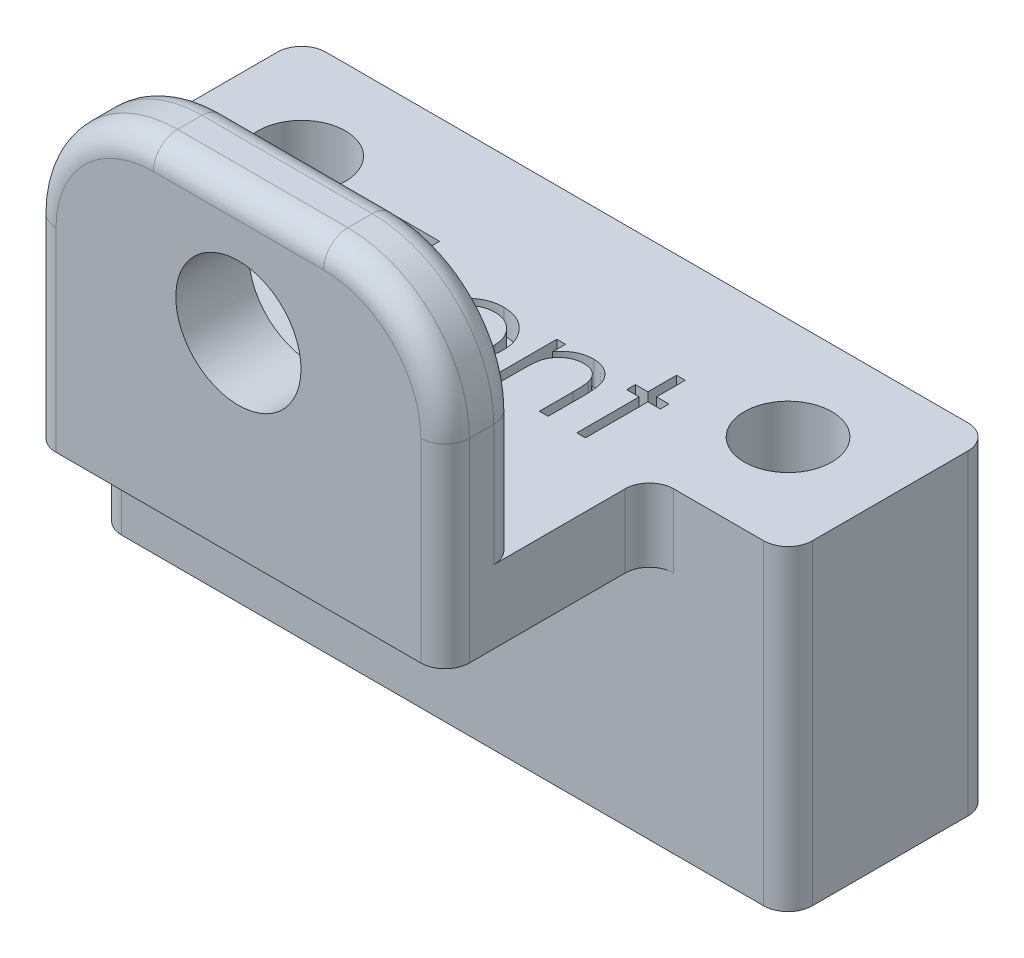
from build123d import *

# Parameters (mm, degrees)
SKETCH1_W                 = 8.4
SKETCH1_H                 = 3
BOSS_EXTRUDE1_DEPTH       = 17
SKETCH1_3_W               = 8.4
SKETCH1_3_H               = 3
BOSS_EXTRUDE3_DEPTH       = 5.7
BOSS_EXTRUDE4_START       = 17
SKETCH1_4_W               = 8.4
SKETCH1_4_H               = 3
BOSS_EXTRUDE4_DEPTH       = 5.7
F_5_0MM_DOWEL_HOLE1_D     = 5.15
F_5_0MM_DOWEL_HOLE1_DEPTH = 3
F_5_0MM_DOWEL_HOLE1_TIP   = 1.547216094
FILLET1_R                 = 5
M3_CLEARANCE_HOLE1_D      = 3.6
FILLET2_R                 = 1
BOSS_EXTRUDE5_START       = 10
SKETCH6_R                 = 1.8
BOSS_EXTRUDE5_DEPTH       = 10
CUT_EXTRUDE1_DEPTH        = 1


with BuildPart() as part:
    # Sketch1 → Boss-Extrude1 (new body)
    with BuildSketch(Plane(origin=(0, 0, 0), x_dir=(0, 0, -1), z_dir=(1, 0, 0))):
        Polygon((0, 13), (0, 0), (8.4, 0), (8.4, 3), (3, 3), (3, 13), align=None)
        with Locations((12.6, 1.5)):
            Rectangle(SKETCH1_W, SKETCH1_H)
    extrude(amount=BOSS_EXTRUDE1_DEPTH)

    # Sketch1<3> → Boss-Extrude3 (add)
    with BuildSketch(Plane(origin=(0, 0, 0), x_dir=(0, 0, -1), z_dir=(1, 0, 0))):
        with Locations((12.6, 1.5)):
            Rectangle(SKETCH1_3_W, SKETCH1_3_H)
    extrude(amount=-BOSS_EXTRUDE3_DEPTH)

    # Sketch1<4> → Boss-Extrude4 (add)
    with BuildSketch(Plane(origin=(0, 0, 0), x_dir=(0, 0, -1), z_dir=(1, 0, 0)).offset(BOSS_EXTRUDE4_START)):
        with Locations((12.6, 1.5)):
            Rectangle(SKETCH1_4_W, SKETCH1_4_H)
    extrude(amount=BOSS_EXTRUDE4_DEPTH)

    # Ø5.0mm Dowel Hole1
    with Locations(Plane.XY):
        with Locations((8.5, 8)):
            Hole(F_5_0MM_DOWEL_HOLE1_D / 2, depth=F_5_0MM_DOWEL_HOLE1_DEPTH)
            with Locations((0, 0, -(F_5_0MM_DOWEL_HOLE1_DEPTH + F_5_0MM_DOWEL_HOLE1_TIP / 2))):  # 118° drill point
                Cone(0, F_5_0MM_DOWEL_HOLE1_D / 2, F_5_0MM_DOWEL_HOLE1_TIP, mode=Mode.SUBTRACT)

    # Fillet1
    fillet1_edges = [part.edges().sort_by_distance(p)[0] for p in [
        (17, 13, -1.5),
        (0, 13, -1.5),
    ]]
    fillet(fillet1_edges, radius=FILLET1_R)

    # M3 Clearance Hole1 (through all)
    with Locations(Plane(origin=(0, 3, 0), x_dir=(1, 0, 0), z_dir=(0, 1, 0))):
        with Locations((18.5, 12.6), (-1.5, 12.6)):
            Hole(M3_CLEARANCE_HOLE1_D / 2)

    # Fillet2
    fillet2_edges = [part.edges().sort_by_distance(p)[0] for p in [
        (17, 5.5, -3),
        (-5.7, 1.5, -16.8),
        (-5.7, 1.5, -8.4),
        (0, 1.5, -8.4),
        (22.7, 1.5, -16.8),
        (22.7, 1.5, -8.4),
        (17, 1.5, -8.4),
        (8.5, 13, 0),
        (8.5, 13, -3),
        (0, 4, 0),
        (17, 4, 0),
        (15.535533906, 11.535533906, 0),
        (1.464466094, 11.535533906, 0),
        (15.535533906, 11.535533906, -3),
        (1.464466094, 11.535533906, -3),
        (0, 5.5, -3),
    ]]
    fillet(fillet2_edges, radius=FILLET2_R)

    # Sketch6 → Boss-Extrude5 (add)
    with BuildSketch(Plane.XZ.offset(BOSS_EXTRUDE5_START)):
        with BuildLine():
            Line((-1, -8.4), (18, -8.4))
            Line((18, -8.4), (21.7, -8.4))
            ThreePointArc((21.7, -8.4), (22.407106781, -8.692893219), (22.7, -9.4))
            Line((22.7, -9.4), (22.7, -15.8))
            ThreePointArc((22.7, -15.8), (22.407106781, -16.507106781), (21.7, -16.8))
            Line((21.7, -16.8), (-4.7, -16.8))
            ThreePointArc((-4.7, -16.8), (-5.407106781, -16.507106781), (-5.7, -15.8))
            Line((-5.7, -15.8), (-5.7, -9.4))
            ThreePointArc((-5.7, -9.4), (-5.407106781, -8.692893219), (-4.7, -8.4))
            Line((-4.7, -8.4), (-1, -8.4))
        make_face()
        with Locations(Location((18.5, -12.6, 0), (0, 0, 90))):
            Circle(SKETCH6_R, mode=Mode.SUBTRACT)
        with Locations(Location((-1.5, -12.6, 0), (0, 0, 90))):
            Circle(SKETCH6_R, mode=Mode.SUBTRACT)
    extrude(amount=-BOSS_EXTRUDE5_DEPTH)

    # Sketch7 → Cut-Extrude1 (cut)
    # profile 1 of 5: a face of its own
    with BuildSketch(Plane(origin=(0, 3, 0), x_dir=(1, 0, 0), z_dir=(0, 1, 0))):
        Polygon((2.423076923, 12.4), (4.371794872, 12.4), (4.371794872, 11.98974359), (2.782051282, 11.98974359), (2.782051282, 10.758974359), (4.371794872, 10.758974359), (4.371794872, 10.348717949), (2.782051282, 10.348717949), (2.782051282, 8.4), (2.423076923, 8.4), align=None)
    # profile 2 of 5: a face of its own
    with BuildSketch(Plane(origin=(0, 3, 0), x_dir=(1, 0, 0), z_dir=(0, 1, 0))):
        with BuildLine():
            Line((4.884615385, 11.323076923), (5.243589744, 11.323076923))
            Line((5.243589744, 11.323076923), (5.243589744, 10.892788462))
            add(Edge.make_bspline(
                [(5.243589744, 10.892788462), (5.270091182, 10.932852265), (5.320774978, 11.009473979), (5.405018325, 11.110810323), (5.491307847, 11.194713233), (5.580056632, 11.261574398), (5.671917318, 11.311646533), (5.764873834, 11.348324288), (5.860388657, 11.370012648), (5.924573713, 11.372908258), (5.956730769, 11.374358974)],
                knots=[0, 0, 0, 0, 1.2804753, 2.448899062, 3.506932113, 4.484331642, 5.4025378, 6.288909075, 7.142734305, 8, 8, 8, 8], degree=3))
            add(Edge.make_bspline(
                [(5.956730769, 11.374358974), (5.981675142, 11.372998373), (6.032999811, 11.370198846), (6.1106942, 11.350529332), (6.190743859, 11.319125878), (6.242335159, 11.289594195), (6.269230769, 11.274198718)],
                knots=[0, 0, 0, 0, 0.901110191, 1.854092781, 2.881294221, 4, 4, 4, 4], degree=3))
            Line((6.269230769, 11.274198718), (6.072115385, 10.963301282))
            add(Edge.make_bspline(
                [(6.072115385, 10.963301282), (6.054847932, 10.971004443), (6.022071001, 10.985626518), (5.974122925, 11.002931673), (5.929915683, 11.013121291), (5.901751617, 11.014664968), (5.888621795, 11.015384615)],
                knots=[0, 0, 0, 0, 1.180555205, 2.24091978, 3.179933427, 4, 4, 4, 4], degree=3))
            add(Edge.make_bspline(
                [(5.888621795, 11.015384615), (5.859815242, 11.013464573), (5.801058225, 11.009548242), (5.714790226, 10.978761033), (5.631079134, 10.929017902), (5.564597234, 10.873850917), (5.513120374, 10.820653434), (5.476388687, 10.774198117), (5.442694119, 10.722108252), (5.410499582, 10.665274328), (5.381166674, 10.602725932), (5.353789909, 10.535087974), (5.329036923, 10.462282113), (5.314922358, 10.411559232), (5.307692308, 10.385576923)],
                knots=[0, 0, 0, 0, 1.125678352, 2.296057538, 3.5422874, 4.923748041, 5.663163013, 6.437101912, 7.23742474, 8.08941207, 8.991984279, 9.93940061, 10.944477711, 12, 12, 12, 12], degree=3))
            add(Edge.make_bspline(
                [(5.307692308, 10.385576923), (5.302283858, 10.36240301), (5.290304553, 10.311074555), (5.278657082, 10.224961955), (5.267149061, 10.123220631), (5.25903864, 10.005567382), (5.251520878, 9.872296017), (5.247280784, 9.723203508), (5.243734337, 9.558136821), (5.243639404, 9.44273756), (5.243589744, 9.382371795)],
                knots=[0, 0, 0, 0, 0.566838948, 1.255505196, 2.06880316, 3.007127437, 4.065329342, 5.249902469, 6.561414163, 8, 8, 8, 8], degree=3))
            Line((5.243589744, 9.382371795), (5.243589744, 8.4))
            Line((5.243589744, 8.4), (4.884615385, 8.4))
            Line((4.884615385, 8.4), (4.884615385, 11.323076923))
        make_face()
    # profile 3 of 5: a face of its own
    with BuildSketch(Plane(origin=(0, 3, 0), x_dir=(1, 0, 0), z_dir=(0, 1, 0))):
        with BuildLine():
            add(Edge.make_bspline(
                [(8.040064103, 11.374358974), (8.094911272, 11.373191099), (8.202453166, 11.37090118), (8.359947893, 11.346426934), (8.510285191, 11.309001374), (8.654040839, 11.257262446), (8.789373748, 11.187911646), (8.91825517, 11.10515817), (9.040331752, 11.00712092), (9.113500928, 10.931283128), (9.150641026, 10.892788462)],
                knots=[0, 0, 0, 0, 1.054011418, 2.066658804, 3.057071809, 4.030435133, 4.997543892, 5.974964718, 6.972108034, 8, 8, 8, 8], degree=3))
            add(Edge.make_bspline(
                [(9.150641026, 10.892788462), (9.182620402, 10.855972478), (9.245960265, 10.783053001), (9.327178229, 10.664818015), (9.397145726, 10.542372185), (9.453217682, 10.414089526), (9.497429138, 10.281089902), (9.528818505, 10.142916175), (9.547489287, 9.999873493), (9.550006964, 9.902726249), (9.551282051, 9.853525641)],
                knots=[0, 0, 0, 0, 1.025258237, 2.030674902, 3.01204498, 3.988269485, 4.97094183, 5.956517959, 6.965070386, 8, 8, 8, 8], degree=3))
            add(Edge.make_bspline(
                [(9.551282051, 9.853525641), (9.550160523, 9.804039861), (9.547944331, 9.706253651), (9.526980198, 9.562231519), (9.494373242, 9.422580293), (9.447708284, 9.287884643), (9.387870445, 9.15773284), (9.314852517, 9.032693355), (9.228142097, 8.912519489), (9.129851815, 8.798231674), (9.021221099, 8.692898857), (8.903374073, 8.60109512), (8.778626606, 8.522441949), (8.645319916, 8.459086046), (8.50467136, 8.409132103), (8.356377568, 8.37404637), (8.200668916, 8.352833017), (8.094352091, 8.350108933), (8.040064103, 8.348717949)],
                knots=[0, 0, 0, 0, 0.998656419, 1.973391657, 2.932242238, 3.890759089, 4.846373663, 5.82037756, 6.809684879, 7.83454468, 8.860553229, 9.859544525, 10.845671541, 11.83227036, 12.833544569, 13.85385346, 14.904124723, 16, 16, 16, 16], degree=3))
            add(Edge.make_bspline(
                [(8.040064103, 8.348717949), (7.985510137, 8.350113602), (7.878663441, 8.352847058), (7.722405176, 8.373963953), (7.573845611, 8.409115933), (7.433012927, 8.45925021), (7.299133102, 8.522443974), (7.17366282, 8.600857334), (7.055720059, 8.692926083), (6.947066363, 8.798224297), (6.848782242, 8.912521389), (6.762070233, 9.032692862), (6.689052717, 9.157732969), (6.62921477, 9.287884609), (6.582549841, 9.422580302), (6.549942878, 9.562231516), (6.528978747, 9.706253652), (6.526762554, 9.804039861), (6.525641026, 9.853525641)],
                knots=[0, 0, 0, 0, 1.099876186, 2.154163076, 3.173186993, 4.173200201, 5.163417411, 6.152872554, 7.150605724, 8.17532212, 9.198891216, 10.186952605, 11.159729845, 12.11414092, 13.071450619, 14.029093627, 15.002601286, 16, 16, 16, 16], degree=3))
            add(Edge.make_bspline(
                [(6.525641026, 9.853525641), (6.526924809, 9.902458836), (6.529466479, 9.999338153), (6.548118489, 10.142111937), (6.579385411, 10.28005181), (6.623649864, 10.412538068), (6.680238654, 10.540258567), (6.749222983, 10.663006945), (6.83126942, 10.780707288), (6.894357365, 10.853532523), (6.926282051, 10.890384615)],
                knots=[0, 0, 0, 0, 1.031353054, 2.041901799, 3.029428768, 4.008703097, 4.981709435, 5.96992636, 6.972712378, 8, 8, 8, 8], degree=3))
            add(Edge.make_bspline(
                [(6.926282051, 10.890384615), (6.963366155, 10.929213117), (7.036298571, 11.005576199), (7.158982831, 11.103327655), (7.287547198, 11.187803168), (7.424375685, 11.255775986), (7.568013237, 11.30930572), (7.719120943, 11.346523452), (7.877150104, 11.370813), (7.985218242, 11.373165203), (8.040064103, 11.374358974)],
                knots=[0, 0, 0, 0, 1.027980169, 2.021703884, 2.998553061, 3.971491411, 4.943284454, 5.930300938, 6.949603206, 8, 8, 8, 8], degree=3))
        make_face()
        with BuildLine():
            add(Edge.make_bspline(
                [(8.038461538, 11.015384615), (7.999675697, 11.014282225), (7.923105264, 11.012105902), (7.810397167, 10.995552868), (7.701894134, 10.969327149), (7.597390312, 10.93206537), (7.497238115, 10.883952343), (7.401341656, 10.824857074), (7.309418867, 10.755562267), (7.223267937, 10.676176357), (7.144202438, 10.589457506), (7.07508475, 10.497059381), (7.0163132, 10.4004807), (6.967353019, 10.29962103), (6.930887661, 10.193458271), (6.904404206, 10.083194693), (6.887866789, 9.968605645), (6.885710928, 9.890707339), (6.884615385, 9.851121795)],
                knots=[0, 0, 0, 0, 1.021534396, 2.016698045, 2.994645724, 3.958388632, 4.93408049, 5.916473867, 6.921342795, 7.962252576, 8.998418191, 10.008913653, 10.997312074, 11.973003931, 12.956656626, 13.948281152, 14.957379055, 16, 16, 16, 16], degree=3))
            add(Edge.make_bspline(
                [(6.884615385, 9.851121795), (6.886451754, 9.799976621), (6.890096605, 9.698463015), (6.919736875, 9.548964589), (6.969321195, 9.405442472), (7.036278086, 9.268738031), (7.120170908, 9.142255427), (7.21901327, 9.029488017), (7.331744356, 8.932132804), (7.457020356, 8.851354694), (7.592282434, 8.787172117), (7.735432515, 8.741687573), (7.884736165, 8.712119924), (7.986771287, 8.709181097), (8.038461538, 8.707692308)],
                knots=[0, 0, 0, 0, 1.016792936, 2.018143844, 3.017858371, 4.030088057, 5.03801393, 6.028138512, 7.003788237, 7.991172063, 8.984598303, 9.972568034, 10.972917682, 12, 12, 12, 12], degree=3))
            add(Edge.make_bspline(
                [(8.038461538, 8.707692308), (8.090148817, 8.709189771), (8.19217807, 8.712145722), (8.341274272, 8.741538658), (8.484033097, 8.787371413), (8.619154683, 8.85128251), (8.744373658, 8.932439556), (8.857915511, 9.028938273), (8.955913924, 9.142554103), (9.039723758, 9.268905564), (9.107777178, 9.405230538), (9.157129409, 9.548991078), (9.186840935, 9.698456269), (9.190476168, 9.799974361), (9.192307692, 9.851121795)],
                knots=[0, 0, 0, 0, 1.02726834, 2.027799167, 3.010890988, 4.004497153, 4.992059811, 5.971914811, 6.958719428, 7.966827853, 8.981595046, 9.981490638, 10.983022906, 12, 12, 12, 12], degree=3))
            add(Edge.make_bspline(
                [(9.192307692, 9.851121795), (9.191212527, 9.890707575), (9.189057408, 9.968606347), (9.172514591, 10.083192009), (9.146051117, 10.193468119), (9.109512126, 10.299584694), (9.060764682, 10.400741842), (9.000859775, 10.496775816), (8.932024318, 10.589777583), (8.852004751, 10.675896029), (8.765943748, 10.755593214), (8.673983704, 10.824883945), (8.578229443, 10.883692625), (8.478368205, 10.9324769), (8.373850985, 10.968988146), (8.265499981, 10.995704297), (8.153272769, 11.01203595), (8.07697672, 11.014261254), (8.038461538, 11.015384615)],
                knots=[0, 0, 0, 0, 1.042956736, 2.052379634, 3.044323526, 4.02829302, 5.004299113, 5.996692471, 7.007513377, 8.048758398, 9.090003419, 10.095195979, 11.07790575, 12.047570684, 13.018257071, 13.989683339, 14.985167495, 16, 16, 16, 16], degree=3))
        make_face(mode=Mode.SUBTRACT)
    # profile 4 of 5: a face of its own
    with BuildSketch(Plane(origin=(0, 3, 0), x_dir=(1, 0, 0), z_dir=(0, 1, 0))):
        with BuildLine():
            Line((10.269230769, 11.323076923), (10.628205128, 11.323076923))
            Line((10.628205128, 11.323076923), (10.628205128, 10.795833333))
            add(Edge.make_bspline(
                [(10.628205128, 10.795833333), (10.666533854, 10.843653588), (10.740912084, 10.936450461), (10.864779893, 11.058416831), (10.995687208, 11.15892566), (11.132832355, 11.239044282), (11.276401509, 11.299440426), (11.425519532, 11.343058633), (11.581079196, 11.369212723), (11.686867124, 11.372630129), (11.740384615, 11.374358974)],
                knots=[0, 0, 0, 0, 1.12780773, 2.188550248, 3.19190651, 4.159438251, 5.104880172, 6.052711206, 7.014878035, 8, 8, 8, 8], degree=3))
            add(Edge.make_bspline(
                [(11.740384615, 11.374358974), (11.794476769, 11.372364465), (11.90034816, 11.36846073), (12.054494516, 11.337584512), (12.198464109, 11.284847077), (12.331743601, 11.212604711), (12.451888988, 11.122768741), (12.557403104, 11.018108419), (12.644675387, 10.897724324), (12.703186659, 10.786040717), (12.741730256, 10.686967809), (12.765995785, 10.602114381), (12.786602621, 10.507579351), (12.804467476, 10.403648392), (12.816555603, 10.289593317), (12.826089651, 10.165881669), (12.832922444, 10.03255352), (12.833193538, 9.940340232), (12.833333333, 9.892788462)],
                knots=[0, 0, 0, 0, 1.235846778, 2.418850247, 3.575807741, 4.728682307, 5.871620074, 6.994088408, 8.11269785, 9.256955736, 9.865816715, 10.540099792, 11.271859618, 12.076849838, 12.949306005, 13.892391288, 14.913166135, 16, 16, 16, 16], degree=3))
            Line((12.833333333, 9.892788462), (12.833333333, 8.4))
            Line((12.833333333, 8.4), (12.474358974, 8.4))
            Line((12.474358974, 8.4), (12.474358974, 9.775))
            add(Edge.make_bspline(
                [(12.474358974, 9.775), (12.474138165, 9.81479708), (12.473715795, 9.890922121), (12.472383627, 9.99991529), (12.46917242, 10.098757094), (12.464660062, 10.187211228), (12.458055456, 10.265192756), (12.451172448, 10.332860501), (12.442755332, 10.390128549), (12.43525486, 10.424602929), (12.431891026, 10.440064103)],
                knots=[0, 0, 0, 0, 1.430800155, 2.736877192, 3.918605307, 4.986035426, 5.920637409, 6.731861385, 7.431261377, 8, 8, 8, 8], degree=3))
            add(Edge.make_bspline(
                [(12.431891026, 10.440064103), (12.419747561, 10.485448314), (12.396375149, 10.572798879), (12.338622025, 10.691283854), (12.265691533, 10.792081783), (12.176665419, 10.874569464), (12.072403619, 10.938764706), (11.953195456, 10.983306369), (11.820191295, 11.011164962), (11.726643429, 11.013938827), (11.677884615, 11.015384615)],
                knots=[0, 0, 0, 0, 1.084156227, 2.086665306, 3.027808233, 3.945421172, 4.874247719, 5.839848303, 6.874090471, 8, 8, 8, 8], degree=3))
            add(Edge.make_bspline(
                [(11.677884615, 11.015384615), (11.649007263, 11.01484061), (11.591859728, 11.013764038), (11.507116903, 11.002962554), (11.424917848, 10.985295748), (11.344437609, 10.961445876), (11.267285845, 10.928688997), (11.190983798, 10.891512574), (11.118404639, 10.84517176), (11.048000756, 10.793525336), (10.982500405, 10.736291956), (10.921553732, 10.67589823), (10.867224566, 10.611583255), (10.818003223, 10.544383315), (10.775513779, 10.4733755), (10.738424536, 10.399244864), (10.70695517, 10.321893836), (10.691317807, 10.268208052), (10.68349359, 10.241346154)],
                knots=[0, 0, 0, 0, 1.023777757, 2.026029729, 3.023749952, 4.003683103, 4.997618607, 5.993177895, 7.010360494, 8.046726602, 9.087585522, 10.09234134, 11.086953743, 12.070360549, 13.043493632, 14.017870808, 15.008233677, 16, 16, 16, 16], degree=3))
            add(Edge.make_bspline(
                [(10.68349359, 10.241346154), (10.678991134, 10.221625922), (10.669189524, 10.178696008), (10.658603033, 10.108245243), (10.648994375, 10.026748129), (10.640952137, 9.934299767), (10.636031661, 9.830576481), (10.630666636, 9.716021237), (10.628713423, 9.590177251), (10.628379304, 9.502563888), (10.628205128, 9.456891026)],
                knots=[0, 0, 0, 0, 0.615963638, 1.340920617, 2.168419149, 3.115676021, 4.16674242, 5.331190069, 6.6087489, 8, 8, 8, 8], degree=3))
            Line((10.628205128, 9.456891026), (10.628205128, 8.4))
            Line((10.628205128, 8.4), (10.269230769, 8.4))
            Line((10.269230769, 8.4), (10.269230769, 11.323076923))
        make_face()
    # profile 5 of 5: a face of its own
    with BuildSketch(Plane(origin=(0, 3, 0), x_dir=(1, 0, 0), z_dir=(0, 1, 0))):
        Polygon((14.012820513, 12.502564103), (14.371794872, 12.502564103), (14.371794872, 11.323076923), (14.884615385, 11.323076923), (14.884615385, 10.964102564), (14.371794872, 10.964102564), (14.371794872, 8.4), (14.012820513, 8.4), (14.012820513, 10.964102564), (13.5, 10.964102564), (13.5, 11.323076923), (14.012820513, 11.323076923), align=None)
    extrude(amount=-CUT_EXTRUDE1_DEPTH, mode=Mode.SUBTRACT)


solid = part.part
